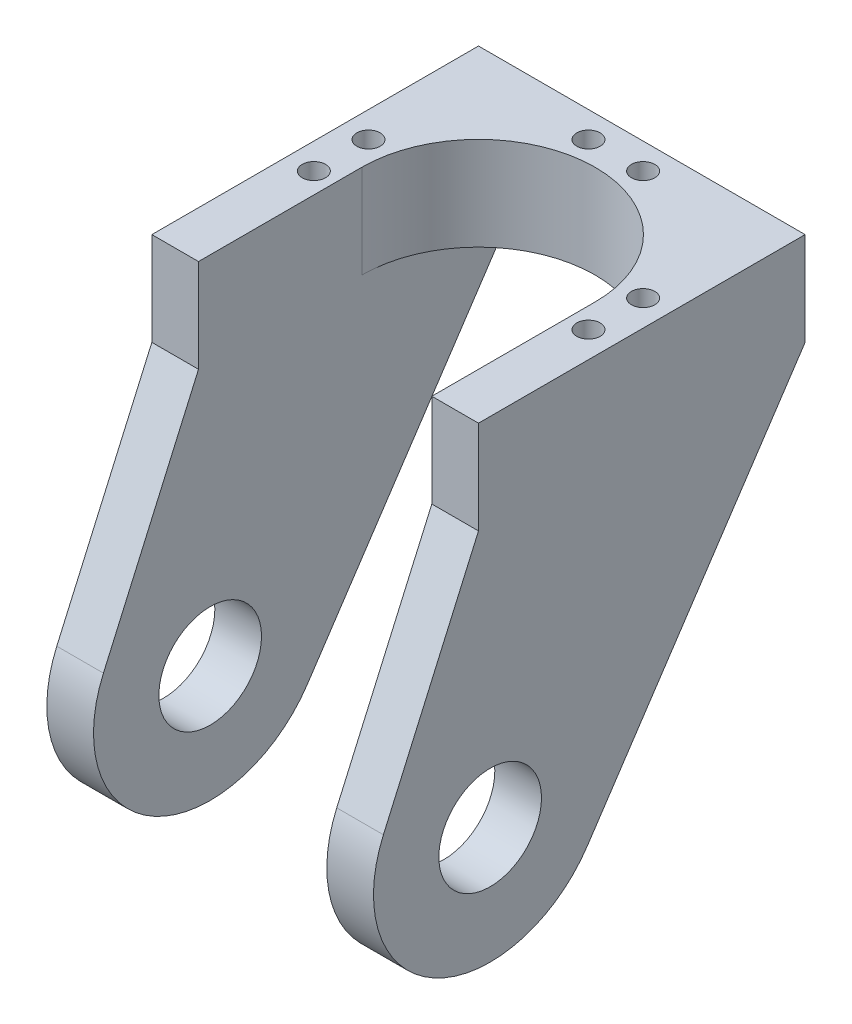
from build123d import *

# Parameters (mm, degrees)
SKETCH1_R               = 2.5
BOSS_EXTRUDE1_DEPTH     = 20
SKETCH7_R               = 25
SKETCH7_R_2             = 11
BOSS_EXTRUDE3_DEPTH     = 70
CUT_EXTRUDE8_DEPTH      = 102
CUT_EXTRUDE8_DEPTH_BACK = 102
SKETCH9_W               = 50
SKETCH9_H               = 83.625795222


with BuildPart() as part:
    # Sketch1 → Boss-Extrude1 (new body)
    with BuildSketch(Plane(origin=(0, 0, 0), x_dir=(1, 0, 0), z_dir=(0, 1, 0))):
        with BuildLine():
            Line((-35, 35), (-35, -35))
            Line((-35, -35), (-25, -35))
            Line((-25, -35), (-25, 0))
            ThreePointArc((-25, 0), (0, 25), (25, 0))
            Line((25, 0), (25, -35))
            Line((25, -35), (35, -35))
            Line((35, -35), (35, 35))
            Line((35, 35), (-35, 35))
        make_face()
        with Locations(Location((-29.423558412, -5.85270966, 0), (0, 0, 270))):
            Circle(SKETCH1_R, mode=Mode.SUBTRACT)
        with Locations(Location((29.423558412, -5.85270966, 0), (0, 0, 270))):
            Circle(SKETCH1_R, mode=Mode.SUBTRACT)
        with Locations(Location((-29.423558412, 5.85270966, 0), (0, 0, 270))):
            Circle(SKETCH1_R, mode=Mode.SUBTRACT)
        with Locations(Location((-5.85270966, 29.423558412, 0), (0, 0, 270))):
            Circle(SKETCH1_R, mode=Mode.SUBTRACT)
        with Locations(Location((29.423558412, 5.85270966, 0), (0, 0, 270))):
            Circle(SKETCH1_R, mode=Mode.SUBTRACT)
        with Locations(Location((5.85270966, 29.423558412, 0), (0, 0, 270))):
            Circle(SKETCH1_R, mode=Mode.SUBTRACT)
    extrude(amount=BOSS_EXTRUDE1_DEPTH)

    # Sketch7 → Boss-Extrude3 (add)
    # profile 1 of 2: a face of its own
    with BuildSketch(Plane(origin=(35, 0, 0), x_dir=(0, 0, -1), z_dir=(1, 0, 0))):
        with BuildLine():
            Line((-35, 0), (-55.374716919, -46.204663298))
            ThreePointArc((-55.374716919, -46.204663298), (-27.345774694, -31.828741331), (-7.5, -56.291651246))
            ThreePointArc((-7.5, -56.291651246), (-8.570053321, -63.527510003), (-11.688612156, -70.143948384))
            Line((-11.688612156, -70.143948384), (35, 0))
            Line((35, 0), (-35, 0))
        make_face()
    # profile 2 of 2: a face of its own
    with BuildSketch(Plane(origin=(35, 0, 0), x_dir=(0, 0, -1), z_dir=(1, 0, 0))):
        with Locations((-32.5, -56.291651246)):
            Circle(SKETCH7_R)
        with Locations((-32.5, -56.291651246)):
            Circle(SKETCH7_R_2, mode=Mode.SUBTRACT)
    extrude(amount=-BOSS_EXTRUDE3_DEPTH)

    # Sketch9 → Cut-Extrude8 (cut, two sides: drawn at the far end of the back side and taken through both)
    with BuildSketch(Plane.XY.offset(-CUT_EXTRUDE8_DEPTH_BACK)):
        with Locations((0, -41.812897611)):
            Rectangle(SKETCH9_W, SKETCH9_H)
    extrude(amount=CUT_EXTRUDE8_DEPTH + CUT_EXTRUDE8_DEPTH_BACK, mode=Mode.SUBTRACT)


solid = part.part
